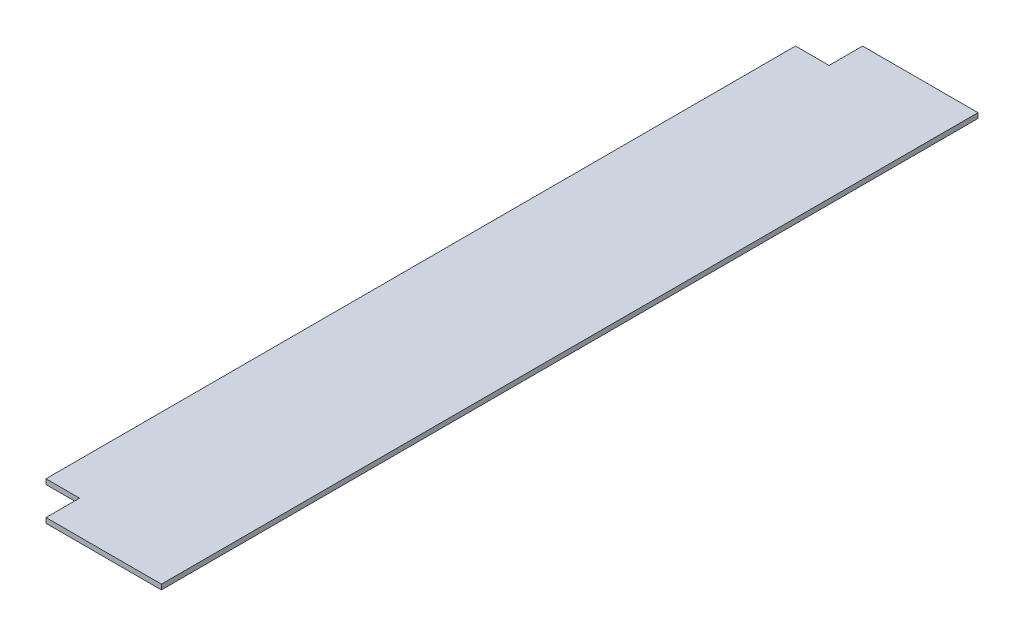
from build123d import *

# Parameters (mm, degrees)
BOSS_EXTRUDE1_DEPTH = 4.5


with BuildPart() as part:
    # Sketch1 → Boss-Extrude1 (new body)
    with BuildSketch(Plane(origin=(0, 0, 0), x_dir=(1, 0, 0), z_dir=(0, 1, 0))):
        Polygon((-66.962544804, 365), (36.197455196, 365), (36.197455196, -365), (-66.962544804, -365), (-66.962544804, -335), (-96.962544804, -335), (-96.962544804, 335), (-66.962544804, 335), align=None)
    extrude(amount=BOSS_EXTRUDE1_DEPTH)


solid = part.part
